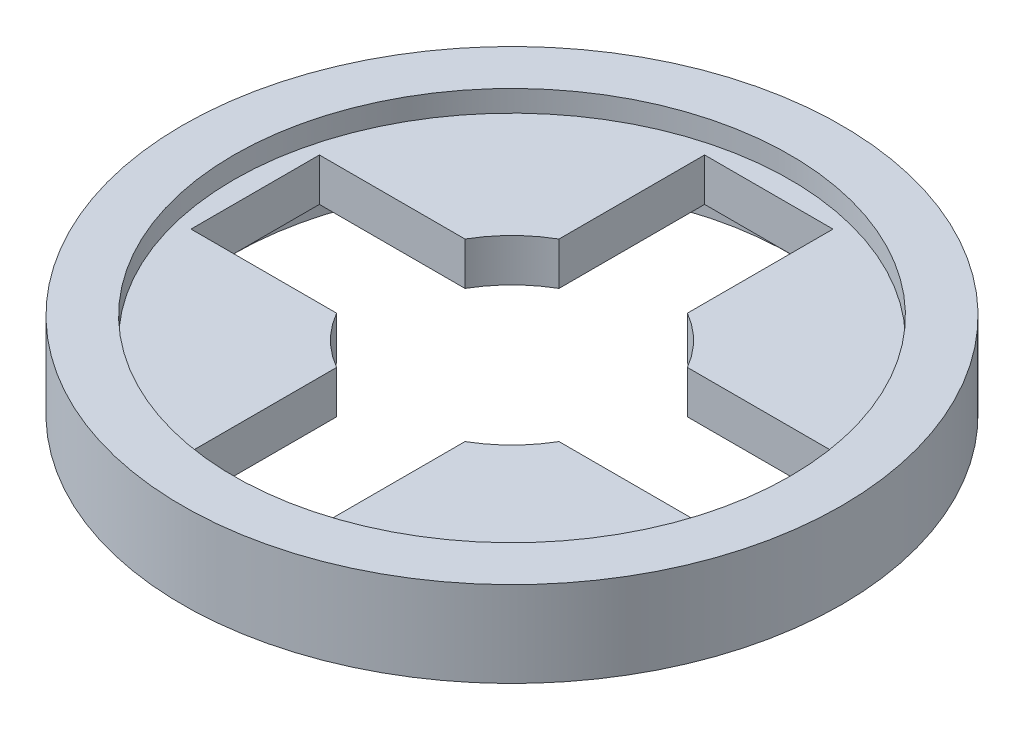
from build123d import *

# Parameters (mm, degrees)
BASE_W             = 2.5
BASE_H             = 1
SKETCH1_R          = 4
SKETCH1_R_2        = 3.85
CUT_EXTRUDE1_DEPTH = 10
SKETCH6_R          = 3.25
CUT_EXTRUDE5_DEPTH = 0.25
CUT_EXTRUDE6_START = -0.25
SKETCH7_R          = 3.25
CUT_EXTRUDE6_DEPTH = 0.25
SKETCH4_W          = 6
SKETCH4_H          = 1.5
SKETCH4_W_2        = 1.5
SKETCH4_H_2        = 6
CUT_EXTRUDE4_DEPTH = 10


with BuildPart() as part:
    # base → Revolution (revolve)
    with BuildSketch(Plane.XY):
        with Locations((2.75, 0)):
            Rectangle(BASE_W, BASE_H)
    revolve(axis=Axis((0, -0.5, 0), (0, 1, 0)))

    # Sketch1 → Cut-Extrude1 (cut)
    with BuildSketch(Plane(origin=(0, -0.5, 0), x_dir=(-1, 0, 0), z_dir=(0, -1, 0))):
        Circle(SKETCH1_R)
        with Locations(Location((0, 0, 0), (0, 0, 180))):
            Circle(SKETCH1_R_2, mode=Mode.SUBTRACT)
    extrude(amount=-CUT_EXTRUDE1_DEPTH, mode=Mode.SUBTRACT)

    # Sketch6 → Cut-Extrude5 (cut)
    with BuildSketch(Plane(origin=(0, -0.5, 0), x_dir=(-1, 0, 0), z_dir=(0, -1, 0))):
        with Locations(Location((0, 0, 0), (0, 0, 180))):
            Circle(SKETCH6_R)
    extrude(amount=-CUT_EXTRUDE5_DEPTH, mode=Mode.SUBTRACT)

    # Sketch7 → Cut-Extrude6 (cut)
    with BuildSketch(Plane(origin=(0, 0.5, 0), x_dir=(1, 0, 0), z_dir=(0, 1, 0)).offset(CUT_EXTRUDE6_START)):
        Circle(SKETCH7_R)
    extrude(amount=CUT_EXTRUDE6_DEPTH, mode=Mode.SUBTRACT)

    # Sketch4 → Cut-Extrude4 (cut)
    with BuildSketch(Plane(origin=(0, -0.5, 0), x_dir=(-1, 0, 0), z_dir=(0, -1, 0))):
        Rectangle(SKETCH4_W, SKETCH4_H)
        Rectangle(SKETCH4_W_2, SKETCH4_H_2)
    extrude(amount=-CUT_EXTRUDE4_DEPTH, mode=Mode.SUBTRACT)


solid = part.part
